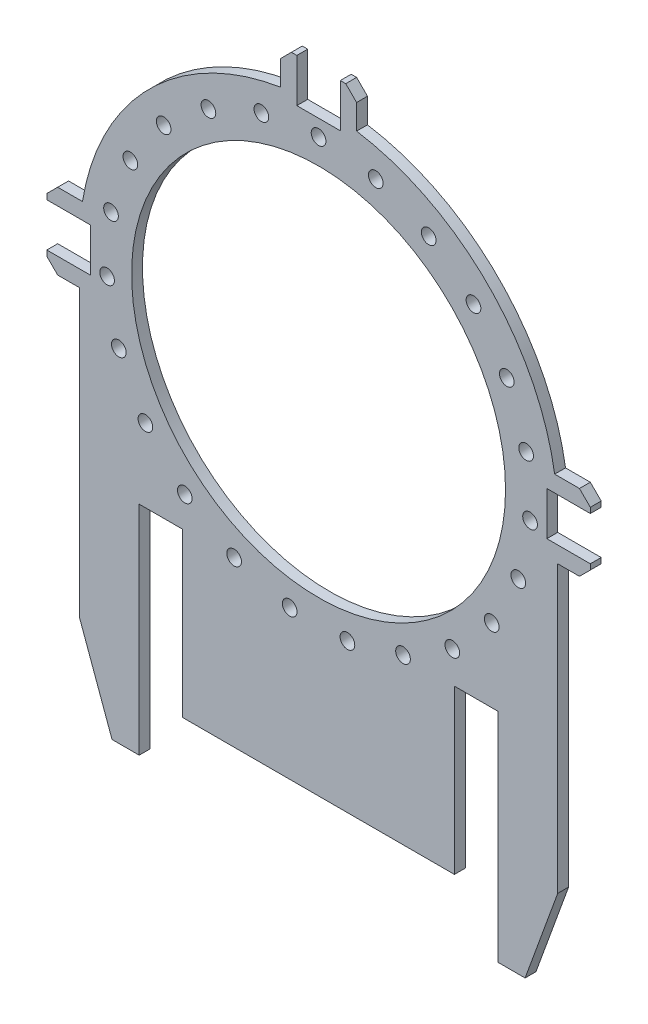
from build123d import *

# Parameters (mm, degrees)
ESQUISSE1_R        = 6.75
ESQUISSE1_R_2      = 172
BOSS_EXTRU_1_DEPTH = 10


with BuildPart() as part:
    # Esquisse1 → Boss.-Extru.1 (new body)
    with BuildSketch(Plane.XY):
        with BuildLine():
            Line((220, -35), (220, -297.575677416))
            Line((220, -297.575677416), (190, -380))
            Line((190, -380), (165, -380))
            Line((165, -380), (165, -180))
            Line((165, -180), (125, -180))
            Line((125, -180), (125, -330))
            Line((125, -330), (-125, -330))
            Line((-125, -330), (-125, -180))
            Line((-125, -180), (-165, -180))
            Line((-165, -180), (-165, -380))
            Line((-165, -380), (-190, -380))
            Line((-190, -380), (-220, -297.575677416))
            Line((-220, -297.575677416), (-220, -35))
            Line((-220, -35), (-240, -35))
            Line((-240, -35), (-250, -25))
            Line((-250, -25), (-250, -20))
            Line((-250, -20), (-210, -20))
            Line((-210, -20), (-210, 20))
            Line((-210, 20), (-250, 20))
            Line((-250, 20), (-250, 25))
            Line((-250, 25), (-240, 35))
            Line((-240, 35), (-217.19806629, 35))
            ThreePointArc((-217.19806629, 35), (-155.563491861, 155.563491861), (-35, 217.19806629))
            Line((-35, 217.19806629), (-35, 240))
            Line((-35, 240), (-25, 250))
            Line((-25, 250), (-20, 250))
            Line((-20, 250), (-20, 210))
            Line((-20, 210), (20, 210))
            Line((20, 210), (20, 250))
            Line((20, 250), (25, 250))
            Line((25, 250), (35, 240))
            Line((35, 240), (35, 217.19806629))
            ThreePointArc((35, 217.19806629), (155.563491861, 155.563491861), (217.19806629, 35))
            Line((217.19806629, 35), (240, 35))
            Line((240, 35), (250, 25))
            Line((250, 25), (250, 20))
            Line((250, 20), (210, 20))
            Line((210, 20), (210, -20))
            Line((210, -20), (250, -20))
            Line((250, -20), (250, -25))
            Line((250, -25), (240, -35))
            Line((240, -35), (220, -35))
        make_face()
        with Locations((0, 195)):
            Circle(ESQUISSE1_R, mode=Mode.SUBTRACT)
        Circle(ESQUISSE1_R_2, mode=Mode.SUBTRACT)
        with Locations((52.610370376, 187.768871033)):
            Circle(ESQUISSE1_R, mode=Mode.SUBTRACT)
        with Locations((101.318870257, 166.611783887)):
            Circle(ESQUISSE1_R, mode=Mode.SUBTRACT)
        with Locations((142.513013034, 133.097862928)):
            Circle(ESQUISSE1_R, mode=Mode.SUBTRACT)
        with Locations((173.137617588, 89.712682358)):
            Circle(ESQUISSE1_R, mode=Mode.SUBTRACT)
        with Locations((190.921397098, 39.673922545)):
            Circle(ESQUISSE1_R, mode=Mode.SUBTRACT)
        with Locations((194.545409992, -13.307270606)):
            Circle(ESQUISSE1_R, mode=Mode.SUBTRACT)
        with Locations((183.740879813, -65.301524373)):
            Circle(ESQUISSE1_R, mode=Mode.SUBTRACT)
        with Locations((159.309129137, -112.452662812)):
            Circle(ESQUISSE1_R, mode=Mode.SUBTRACT)
        with Locations((123.062149144, -151.263701687)):
            Circle(ESQUISSE1_R, mode=Mode.SUBTRACT)
        with Locations((77.68821252, -178.856203794)):
            Circle(ESQUISSE1_R, mode=Mode.SUBTRACT)
        with Locations((26.552496574, -193.183759477)):
            Circle(ESQUISSE1_R, mode=Mode.SUBTRACT)
        with Locations((-26.552496574, -193.183759477)):
            Circle(ESQUISSE1_R, mode=Mode.SUBTRACT)
        with Locations((-77.68821252, -178.856203794)):
            Circle(ESQUISSE1_R, mode=Mode.SUBTRACT)
        with Locations((-123.062149144, -151.263701687)):
            Circle(ESQUISSE1_R, mode=Mode.SUBTRACT)
        with Locations((-159.309129137, -112.452662812)):
            Circle(ESQUISSE1_R, mode=Mode.SUBTRACT)
        with Locations((-183.740879813, -65.301524373)):
            Circle(ESQUISSE1_R, mode=Mode.SUBTRACT)
        with Locations((-194.545409992, -13.307270606)):
            Circle(ESQUISSE1_R, mode=Mode.SUBTRACT)
        with Locations((-190.921397098, 39.673922545)):
            Circle(ESQUISSE1_R, mode=Mode.SUBTRACT)
        with Locations((-173.137617588, 89.712682358)):
            Circle(ESQUISSE1_R, mode=Mode.SUBTRACT)
        with Locations((-142.513013034, 133.097862928)):
            Circle(ESQUISSE1_R, mode=Mode.SUBTRACT)
        with Locations((-101.318870257, 166.611783887)):
            Circle(ESQUISSE1_R, mode=Mode.SUBTRACT)
        with Locations((-52.610370376, 187.768871033)):
            Circle(ESQUISSE1_R, mode=Mode.SUBTRACT)
    extrude(amount=BOSS_EXTRU_1_DEPTH)


solid = part.part
